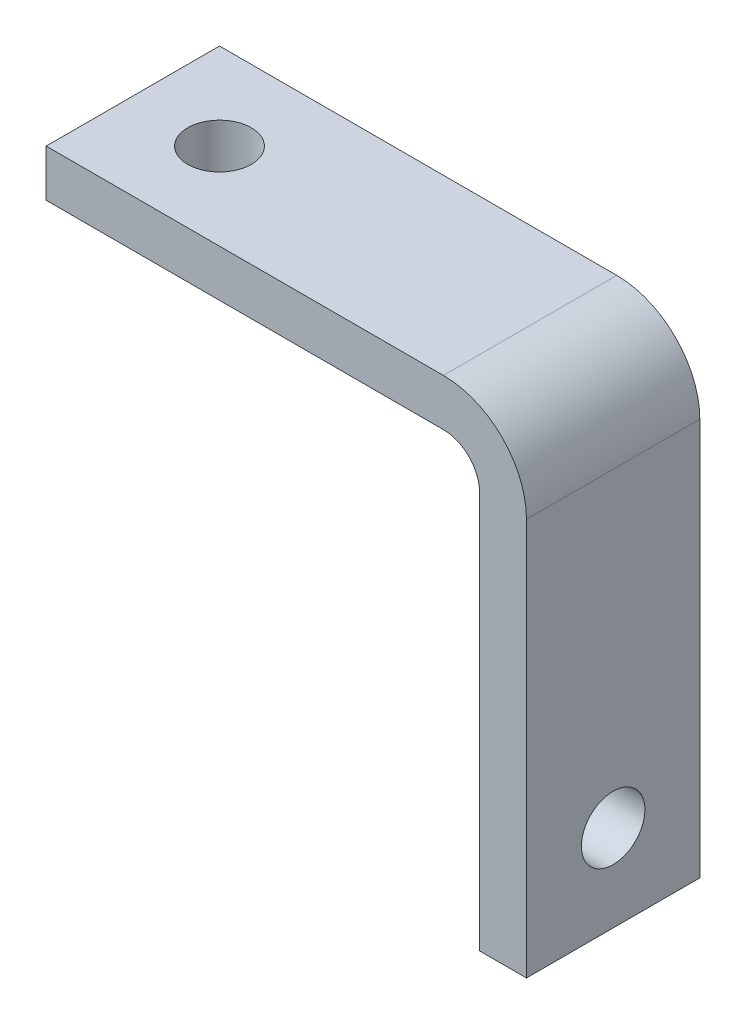
from build123d import *

# Parameters (mm, degrees)
SKETCH1_W               = 33.25
SKETCH1_H               = 12
BOSS_EXTRUDE1_DEPTH     = 3.25
CUT_EXTRUDE1_DEPTH      = 36.498239393
CUT_EXTRUDE1_DEPTH_BACK = 36.498239393
SKETCH2_R               = 2.2
SKETCH3_W               = 3.25
SKETCH3_H               = 12
BOSS_EXTRUDE2_DEPTH     = 30
SKETCH4_R               = 2.2
CUT_EXTRUDE2_DEPTH      = 47.363374554
FILLET2_R               = 5.75
FILLET3_R               = 2.5


with BuildPart() as part:
    # Sketch1 → Boss-Extrude1 (new body)
    with BuildSketch(Plane(origin=(0, 0, 0), x_dir=(1, 0, 0), z_dir=(0, 1, 0))):
        with Locations((-16.625, 6)):
            Rectangle(SKETCH1_W, SKETCH1_H)
    extrude(amount=BOSS_EXTRUDE1_DEPTH)

    # Sketch2 → Cut-Extrude1 (cut, two sides: drawn at the far end of the back side and taken through both)
    with BuildSketch(Plane(origin=(0, 3.25, 0), x_dir=(1, 0, 0), z_dir=(0, 1, 0)).offset(-CUT_EXTRUDE1_DEPTH_BACK)):
        with Locations(Location((-27.25, 6, 0), (0, 0, 270))):
            Circle(SKETCH2_R)
    extrude(amount=CUT_EXTRUDE1_DEPTH + CUT_EXTRUDE1_DEPTH_BACK, mode=Mode.SUBTRACT)

    # Sketch3 → Boss-Extrude2 (add)
    with BuildSketch(Plane.XZ):
        with Locations((-1.625, -6)):
            Rectangle(SKETCH3_W, SKETCH3_H)
    extrude(amount=BOSS_EXTRUDE2_DEPTH)

    # Sketch4 → Cut-Extrude2 (cut, through all)
    with BuildSketch(Plane(origin=(0, 0, 0), x_dir=(0, 0, -1), z_dir=(1, 0, 0))):
        with Locations((6, -24)):
            Circle(SKETCH4_R)
    extrude(amount=-CUT_EXTRUDE2_DEPTH, mode=Mode.SUBTRACT)

    # Fillet2
    fillet2_edges = [part.edges().sort_by_distance(p)[0] for p in [
        (0, 3.25, -6),
    ]]
    fillet(fillet2_edges, radius=FILLET2_R)

    # Fillet3
    fillet3_edges = [part.edges().sort_by_distance(p)[0] for p in [
        (-3.25, 0, -6),
    ]]
    fillet(fillet3_edges, radius=FILLET3_R)


solid = part.part
